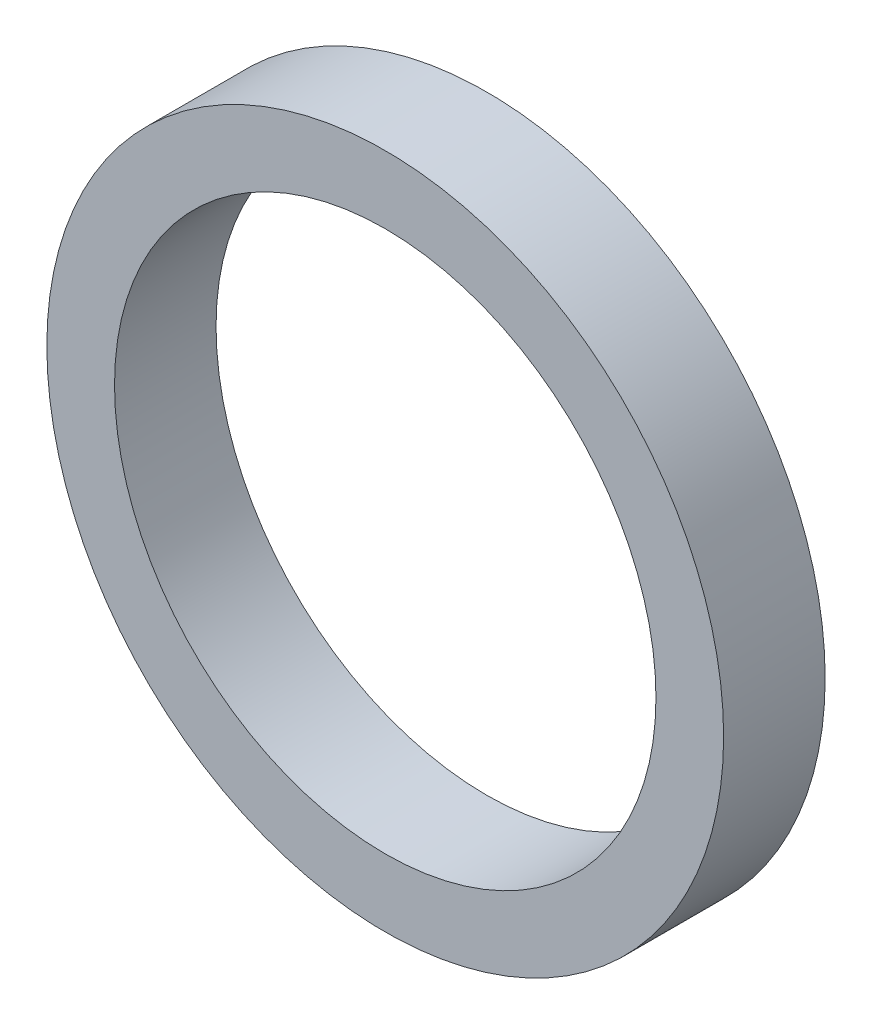
from build123d import *

# Parameters (mm, degrees)
SKETCH1_R           = 5
SKETCH1_R_2         = 4
BOSS_EXTRUDE1_DEPTH = 0.75


with BuildPart() as part:
    # Sketch1 → Boss-Extrude1 (new, symmetric)
    with BuildSketch(Plane.XY):
        Circle(SKETCH1_R)
        Circle(SKETCH1_R_2, mode=Mode.SUBTRACT)
    extrude(amount=BOSS_EXTRUDE1_DEPTH, both=True)


solid = part.part
